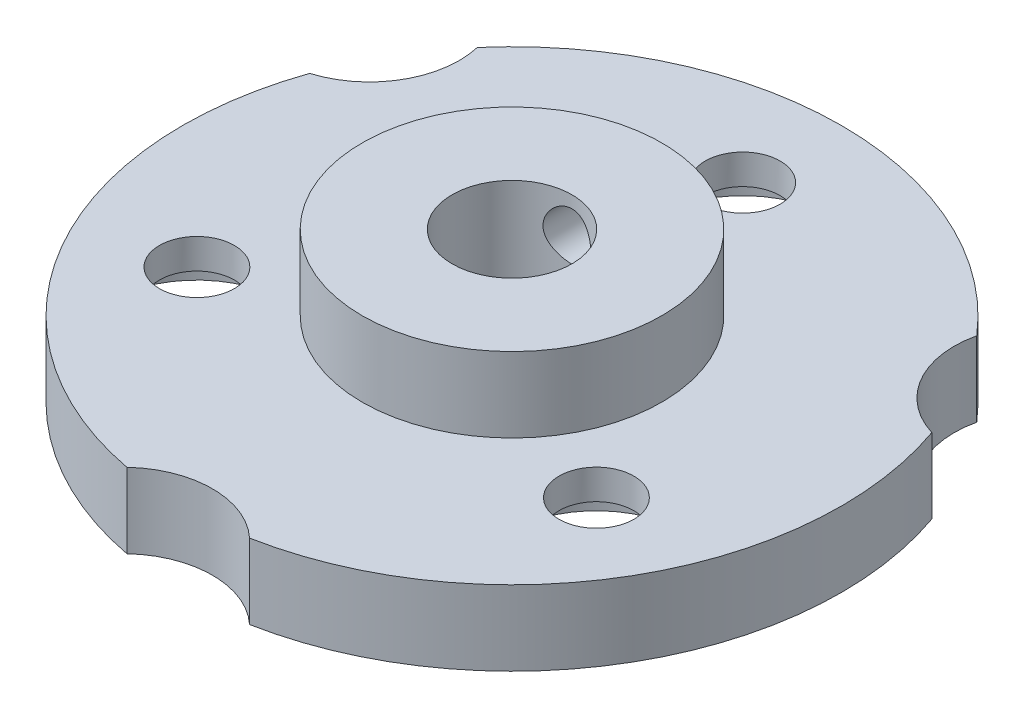
from build123d import *

# Parameters (mm, degrees)
ESBO_O1_R                                      = 11
RESSALTO_EXTRUS_O1_DEPTH                       = 2.5
ESBO_O3_R                                      = 1.25
CORTE_EXTRUS_O1_DEPTH                          = 2.5
ESBO_O18_R                                     = 5
RESSALTO_EXTRUS_O5_DEPTH                       = 2.5
ESBO_O20_R                                     = 2
CORTE_EXTRUS_O5_DEPTH                          = 5.5
BROCA_DE_ROSQUEAR_PARA_TARRAXA_DE_M2X0_4_REACH = 21.785
BROCA_DE_ROSQUEAR_PARA_TARRAXA_DE_M2_2_R       = 0.8
ESBO_O22_R                                     = 3
CORTE_EXTRUS_O6_DEPTH                          = 5.5
ESBO_O23_R                                     = 3
CORTE_EXTRUS_O7_DEPTH                          = 1.5


with BuildPart() as part:
    # Esboço1 → Ressalto-extrusão1 (new body)
    with BuildSketch(Plane(origin=(0, 0, 0), x_dir=(1, 0, 0), z_dir=(0, 1, 0))):
        with Locations(Location((0, 0, 0), (0, 0, 270))):
            Circle(ESBO_O1_R)
    extrude(amount=RESSALTO_EXTRUS_O1_DEPTH)

    # Esboço3 → Corte-extrusão1 (cut)
    with BuildSketch(Plane(origin=(0, 2.5, 0), x_dir=(1, 0, 0), z_dir=(0, 1, 0))):
        with Locations(Location((0, 7.7, 0), (0, 0, 270))):
            Circle(ESBO_O3_R)
        with Locations(Location((6.668395609, -3.85, 0), (0, 0, 270))):
            Circle(ESBO_O3_R)
        with Locations(Location((-6.668395609, -3.85, 0), (0, 0, 270))):
            Circle(ESBO_O3_R)
    extrude(amount=-CORTE_EXTRUS_O1_DEPTH, mode=Mode.SUBTRACT)

    # Esboço18 → Ressalto-extrusão5 (add)
    with BuildSketch(Plane(origin=(0, 2.5, 0), x_dir=(1, 0, 0), z_dir=(0, 1, 0))):
        with Locations(Location((0, 0, 0), (0, 0, 270))):
            Circle(ESBO_O18_R)
    extrude(amount=RESSALTO_EXTRUS_O5_DEPTH)

    # Esboço20 → Corte-extrusão5 (cut)
    with BuildSketch(Plane(origin=(0, 5, 0), x_dir=(1, 0, 0), z_dir=(0, 1, 0))):
        with Locations(Location((0, 0, 0), (0, 0, 270))):
            Circle(ESBO_O20_R)
    extrude(amount=-CORTE_EXTRUS_O5_DEPTH, mode=Mode.SUBTRACT)

    # Broca de rosquear para tarraxa de M2 2 (on position points) → Broca de rosquear para tarraxa de M2x0.42 (cut, up to next)
    with BuildSketch(Plane(origin=(0.002598781, 3.792959438, -4.999999325), x_dir=(-0.999999864927, 0, -0.000519756122), z_dir=(0.000519756122, 0, -0.999999864927)), mode=Mode.PRIVATE) as broca_de_rosquear_para_tarraxa_de_m2x0_4_sk1:
        Circle(BROCA_DE_ROSQUEAR_PARA_TARRAXA_DE_M2_2_R)
    broca_de_rosquear_para_tarraxa_de_m2x0_4_tool1 = extrude(broca_de_rosquear_para_tarraxa_de_m2x0_4_sk1.sketch, amount=-BROCA_DE_ROSQUEAR_PARA_TARRAXA_DE_M2X0_4_REACH, mode=Mode.PRIVATE) & part.part
    add(broca_de_rosquear_para_tarraxa_de_m2x0_4_tool1.solids().sort_by_distance((0.002599, 3.792959, -4.999999))[0], mode=Mode.SUBTRACT)

    # Esboço22 → Corte-extrusão6 (cut)
    with BuildSketch(Plane(origin=(0, 2.5, 0), x_dir=(1, 0, 0), z_dir=(0, 1, 0))):
        with Locations((-11.258330249, 6.5)):
            Circle(ESBO_O22_R)
        with Locations((0, -13)):
            Circle(ESBO_O22_R)
        with Locations((11.258330249, 6.5)):
            Circle(ESBO_O22_R)
    extrude(amount=-CORTE_EXTRUS_O6_DEPTH, mode=Mode.SUBTRACT)

    # Esboço23 → Corte-extrusão7 (cut)
    with BuildSketch(Plane(origin=(0, 0, 0), x_dir=(-1, 0, 0), z_dir=(0, -1, 0))):
        with Locations(Location((-6.668395609, -3.85, 0), (0, 0, 90))):
            Circle(ESBO_O23_R)
        with Locations(Location((6.668395609, -3.85, 0), (0, 0, 90))):
            Circle(ESBO_O23_R)
        with Locations(Location((0, 7.7, 0), (0, 0, 90))):
            Circle(ESBO_O23_R)
    extrude(amount=-CORTE_EXTRUS_O7_DEPTH, mode=Mode.SUBTRACT)


solid = part.part
